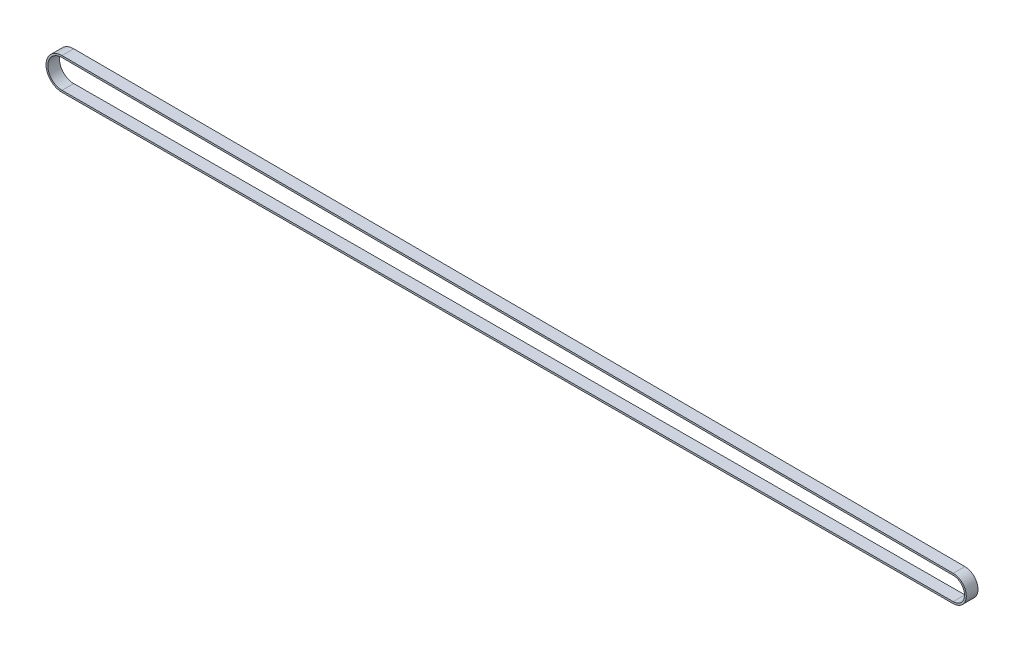
from build123d import *

# Parameters (mm, degrees)
EXTRUDE_THIN1_DEPTH = 2.5


with BuildPart() as part:
    # Sketch2 → Extrude-Thin1 (new, symmetric)
    with BuildSketch(Plane.XY):
        with BuildLine():
            Line((-380.478516689, -31.081805582), (0.017698817, -32.281799614))
            ThreePointArc((0.017698817, -32.281799614), (5.612, -37.893771705), (0.017698817, -43.505743796))
            Line((0.017698817, -43.505743796), (-380.478516689, -44.705737829))
            ThreePointArc((-380.478516689, -44.705737829), (-387.312, -37.893771705), (-380.478516689, -31.081805582))
        make_face()
        with BuildLine():
            Line((-380.480919842, -31.843801792), (0.015295664, -33.043795824))
            ThreePointArc((0.015295664, -33.043795824), (4.85, -37.893771705), (0.015295664, -42.743747586))
            Line((0.015295664, -42.743747586), (-380.480919842, -43.943741618))
            ThreePointArc((-380.480919842, -43.943741618), (-386.55, -37.893771705), (-380.480919842, -31.843801792))
        make_face(mode=Mode.SUBTRACT)
    extrude(amount=EXTRUDE_THIN1_DEPTH, both=True)


solid = part.part
